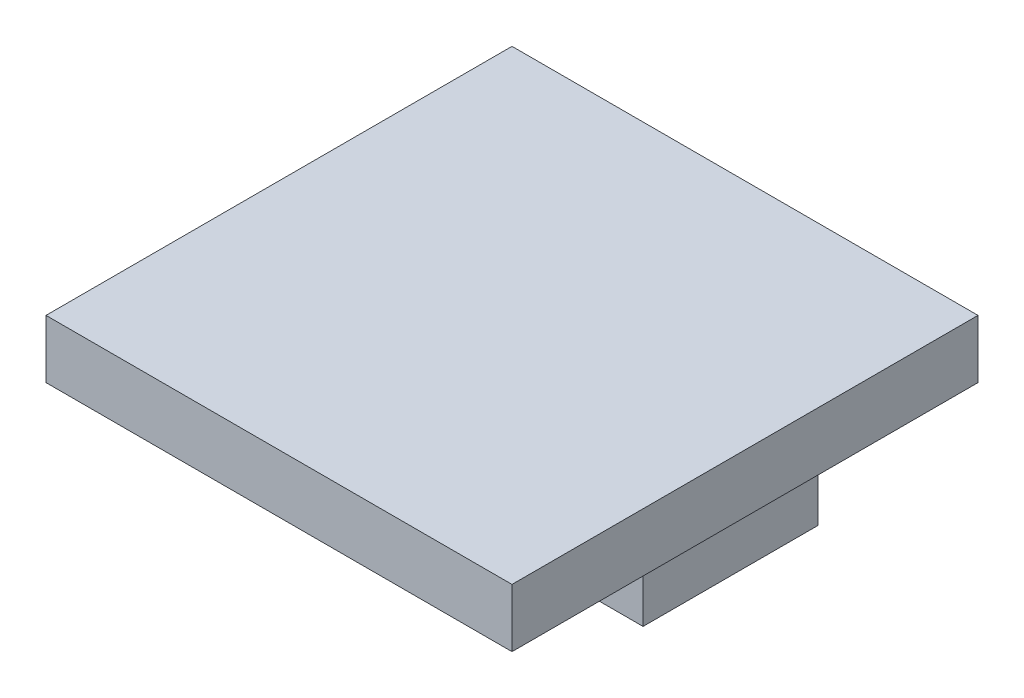
from build123d import *

# Parameters (mm, degrees)
SKETCH1_W           = 25
SKETCH1_H           = 12
BOSS_EXTRUDE1_DEPTH = 4
SKETCH3_W           = 32
SKETCH3_H           = 32
BOSS_EXTRUDE3_DEPTH = 4


with BuildPart() as part:
    # Sketch1 → Boss-Extrude1 (new body)
    with BuildSketch(Plane(origin=(0, 0, 0), x_dir=(1, 0, 0), z_dir=(0, 1, 0))):
        Rectangle(SKETCH1_W, SKETCH1_H)
    extrude(amount=BOSS_EXTRUDE1_DEPTH)

    # Sketch3 → Boss-Extrude3 (add)
    with BuildSketch(Plane(origin=(0, 4, 0), x_dir=(1, 0, 0), z_dir=(0, 1, 0))):
        with Locations((-2.5, 0)):
            Rectangle(SKETCH3_W, SKETCH3_H)
    extrude(amount=BOSS_EXTRUDE3_DEPTH)


solid = part.part
